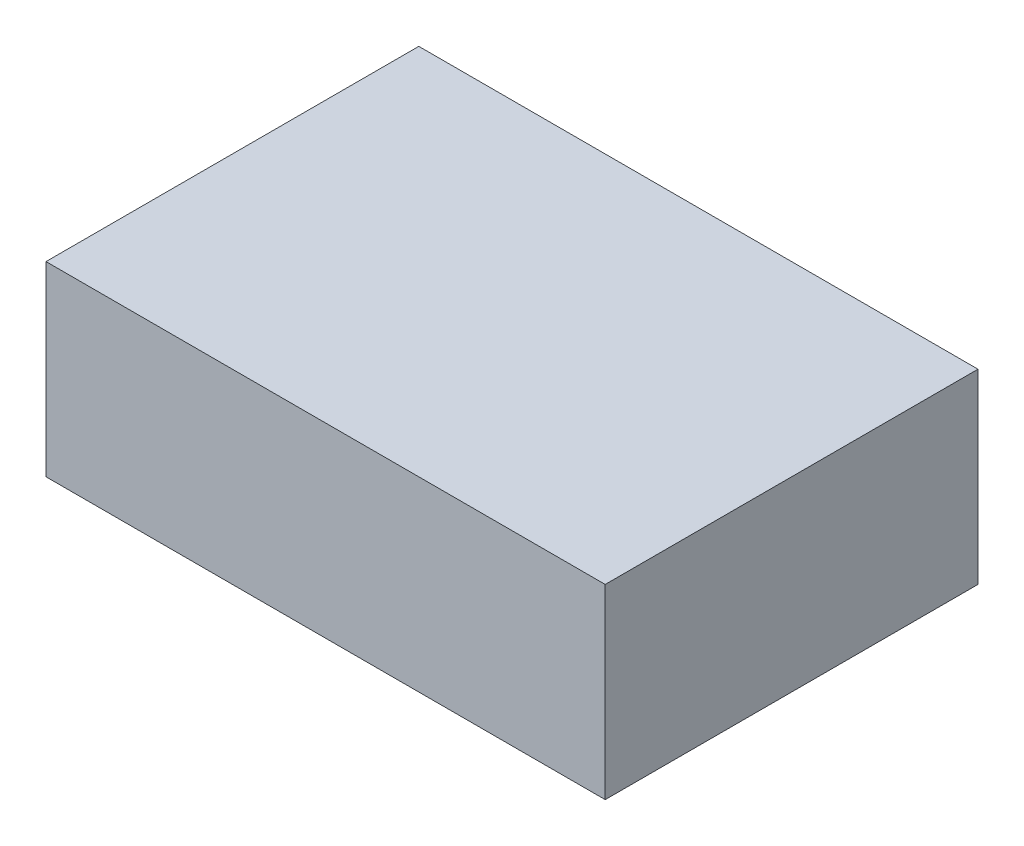
from build123d import *

# Parameters (mm, degrees)
SKETCH1_W           = 76.2
SKETCH1_H           = 50.8
BOSS_EXTRUDE1_DEPTH = 25.4


with BuildPart() as part:
    # Sketch1 → Boss-Extrude1 (new body)
    with BuildSketch(Plane(origin=(0, 0, 0), x_dir=(1, 0, 0), z_dir=(0, 1, 0))):
        with Locations((38.1, 25.4)):
            Rectangle(SKETCH1_W, SKETCH1_H)
    extrude(amount=BOSS_EXTRUDE1_DEPTH)


solid = part.part
